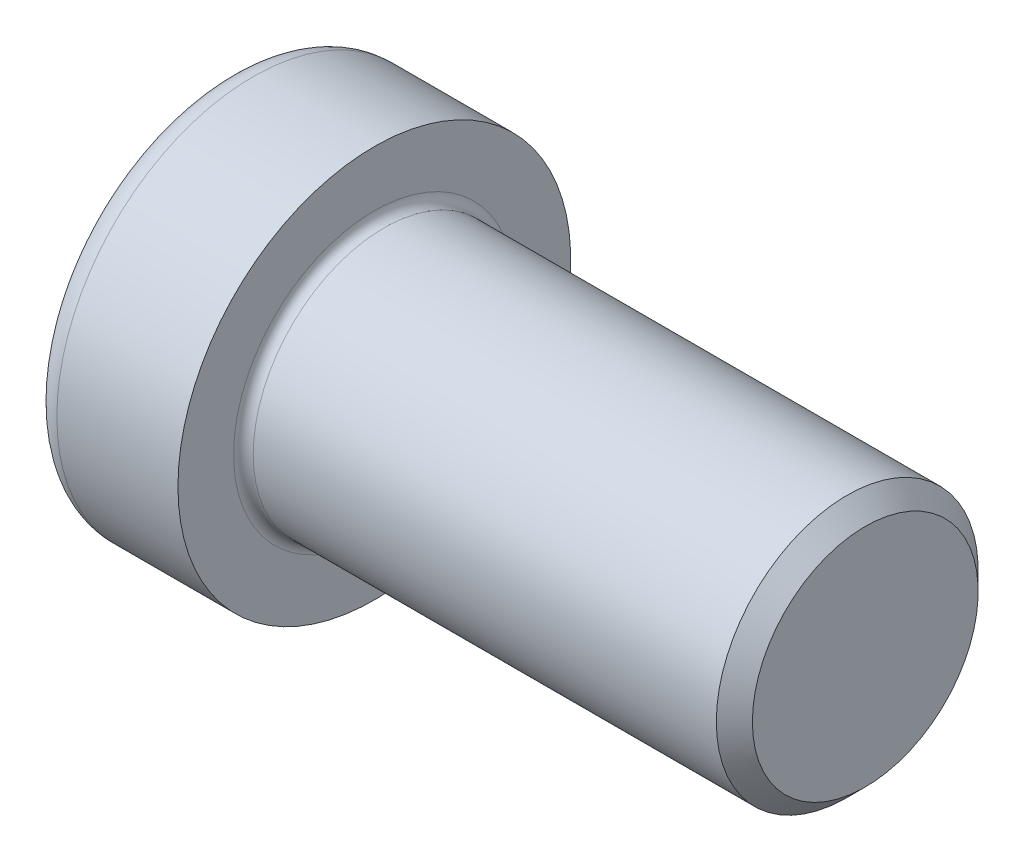
from build123d import *

# Parameters (mm, degrees)
FILLET1_R   = 0.6
FILLET2_R   = 1.6
HEX_2_DEPTH = 5.5


with BuildPart() as part:
    # BodySke → Base-Revolve (revolve)
    with BuildSketch(Plane.XY, mode=Mode.PRIVATE) as base_revolve_sk:
        Polygon((0, 0), (0, 12), (9, 12), (9, 8), (37.8985, 8), (39, 6.8985), (39, 0), align=None)
    revolve(base_revolve_sk.sketch.rotate(Axis((-31.75, 0, 0), (1, 0, 0)), 90), axis=Axis((-31.75, 0, 0), (1, 0, 0)))

    # Fillet1
    fillet1_edges = [part.edges().sort_by_distance(p)[0] for p in [
        (9, 0, -8),
    ]]
    fillet(fillet1_edges, radius=FILLET1_R)

    # Fillet2
    fillet2_edges = [part.edges().sort_by_distance(p)[0] for p in [
        (0, 0, -12),
    ]]
    fillet(fillet2_edges, radius=FILLET2_R)

    # Sketch2 → Hex-PreBroach (revolve, cut)
    with BuildSketch(Plane.XY, mode=Mode.PRIVATE) as hex_prebroach_sk:
        Polygon((0, 6), (5.5, 6), (8.964101615, 0), (0, 0), align=None)
    revolve(hex_prebroach_sk.sketch.rotate(Axis((0, 0, 0), (1, 0, 0)), 90), axis=Axis((0, 0, 0), (1, 0, 0)), mode=Mode.SUBTRACT)

    # Sketch3 → Hex 2 (cut)
    with BuildSketch(Plane(origin=(0, 0, 0), x_dir=(0, 0.500000000000001, 0.866025403784438), z_dir=(-1, 0, 0))):
        Polygon((3.464101615, 6), (-3.464101615, 6), (-6.92820323, 0), (-3.464101615, -6), (3.464101615, -6), (6.92820323, 0), align=None)
    extrude(amount=-HEX_2_DEPTH, mode=Mode.SUBTRACT)


solid = part.part
